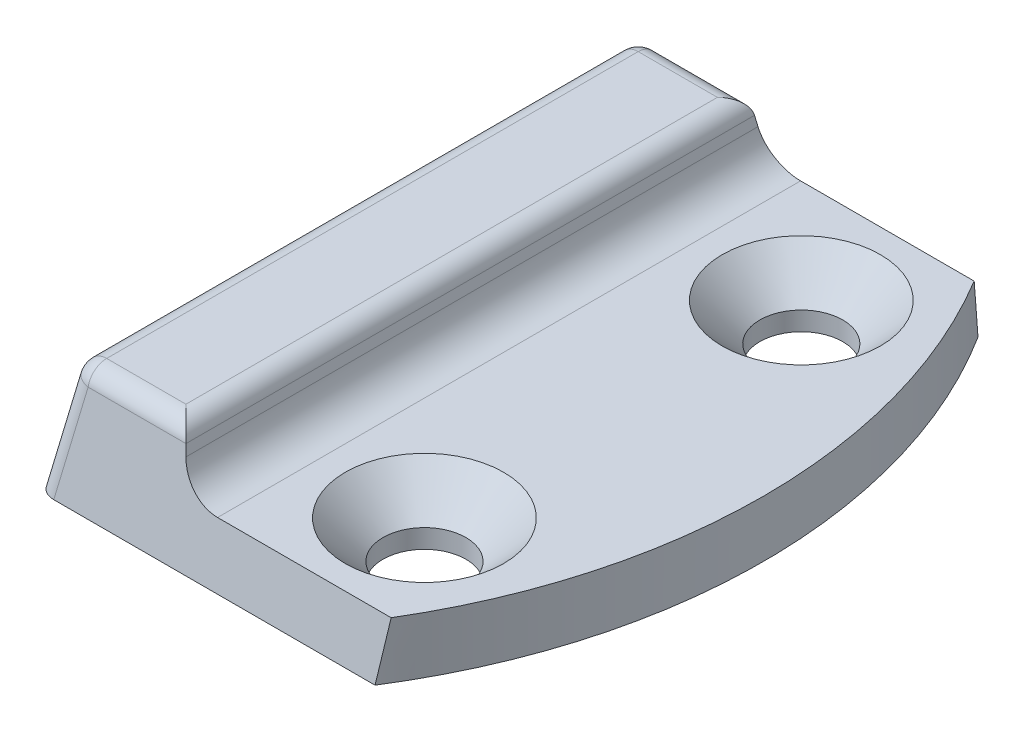
from build123d import *

# Parameters (mm, degrees)
SKETCH_1_W               = 4
SKETCH_1_H               = 16
EXTRUDE_1_DEPTH          = 3
EXTRUDE_1_TAPER          = 10
EXTRUDE_3_DEPTH          = 1.5
EXTRUDE_4_DEPTH          = 16
CUT_EXTRUDE_1_REACH      = 19.263
CUT_EXTRUDE_1_END_RADIUS = 15
SKETCH_6_R               = 1.1
CUT_EXTRUDE_2_DEPTH      = 18.066048222
CHAMFER_1_SIZE           = 1
FILLET_2_R               = 1
FILLET_3_R               = 0.5


with BuildPart() as part:
    # Эскиз1 → Бобышка-Вытянуть1 (new body)
    with BuildSketch(Plane(origin=(0, 0, 0), x_dir=(1, 0, 0), z_dir=(0, 1, 0))):
        with Locations((5.671019058, 0)):
            Rectangle(SKETCH_1_W, SKETCH_1_H)
    extrude(amount=EXTRUDE_1_DEPTH, taper=EXTRUDE_1_TAPER)



with BuildPart() as body_2:
    # Эскиз2 → Бобышка-Вытянуть3 (new body)
    with BuildSketch(Plane(origin=(0, 0, 0), x_dir=(1, 0, 0), z_dir=(0, 1, 0))):
        with BuildLine():
            Line((7.671019058, 8), (12.68857754, 8))
            ThreePointArc((12.68857754, 8), (15, 0), (12.68857754, -8))
            Line((12.68857754, -8), (7.671019058, -8))
            Line((7.671019058, -8), (7.671019058, 8))
        make_face()
    extrude(amount=EXTRUDE_3_DEPTH)


with BuildPart() as part_1:
    add(part.part)

    add(body_2.part)  # Бобышка-Вытянуть4 merges body 2
    # Эскиз3 → Бобышка-Вытянуть4 (add)
    with BuildSketch(Plane.XY.offset(8)):
        Polygon((7.671019058, 1.5), (7.406528587, 1.5), (7.671019058, 0), align=None)
    extrude(amount=-EXTRUDE_4_DEPTH)

    # Вырез-Вытянуть1: up to this cylinder (the profile starts inside it)
    cut_extrude_1_end = Plane(origin=(0, 1, 0), z_dir=(0, -1, 0)) * Cylinder(CUT_EXTRUDE_1_END_RADIUS, 69.526, mode=Mode.PRIVATE)
    # Эскиз5 → Вырез-Вытянуть1 (cut, up to the surface)
    with BuildSketch(Plane(origin=(0, 0, 0), x_dir=(0, 0, -1), z_dir=(1, 0, 0)), mode=Mode.PRIVATE) as cut_extrude_1_sk1:
        Polygon((-8, 0), (-8, 1.5), (-7.735509529, 1.5), align=None)
    cut_extrude_1_tool1 = extrude(cut_extrude_1_sk1.sketch, amount=CUT_EXTRUDE_1_REACH, mode=Mode.PRIVATE) & cut_extrude_1_end
    add(cut_extrude_1_tool1.solids().sort_by_distance((0, 1, 7.911837))[0], mode=Mode.SUBTRACT)
    # Эскиз5 → Вырез-Вытянуть1 (cut, up to the surface)
    with BuildSketch(Plane(origin=(0, 0, 0), x_dir=(0, 0, -1), z_dir=(1, 0, 0)), mode=Mode.PRIVATE) as cut_extrude_1_sk2:
        Polygon((7.735509529, 1.5), (8, 0), (8, 1.5), align=None)
    cut_extrude_1_tool2 = extrude(cut_extrude_1_sk2.sketch, amount=CUT_EXTRUDE_1_REACH, mode=Mode.PRIVATE) & cut_extrude_1_end
    add(cut_extrude_1_tool2.solids().sort_by_distance((0, 1, -7.911837))[0], mode=Mode.SUBTRACT)

    # Эскиз6 → Вырез-Вытянуть2 (cut, through all)
    with BuildSketch(Plane(origin=(0, 1.5, 0), x_dir=(1, 0, 0), z_dir=(0, 1, 0))):
        with Locations(Location((11, 5, 0), (0, 0, 180))):
            Circle(SKETCH_6_R)
        with Locations(Location((11, -5, 0), (0, 0, 180))):
            Circle(SKETCH_6_R)
    extrude(amount=-CUT_EXTRUDE_2_DEPTH, mode=Mode.SUBTRACT)

    # Фаска1
    chamfer_1_edges = [part_1.edges().sort_by_distance(p)[0] for p in [
        (12.1, 1.5, -5),
        (12.1, 1.5, 5),
    ]]
    chamfer(chamfer_1_edges, length=CHAMFER_1_SIZE)

    # Скругление2
    fillet_2_edges = [part_1.edges().sort_by_distance(p)[0] for p in [
        (7.406528587, 1.5, 0),
    ]]
    fillet(fillet_2_edges, radius=FILLET_2_R)

    # Скругление3
    fillet_3_edges = [part_1.edges().sort_by_distance(p)[0] for p in [
        (4.2, 3, 0),
        (5.671019058, 3, 7.471019058),
        (7.142038116, 3, 0),
        (3.935509529, 1.5, 7.735509529),
        (3.935509529, 1.5, -7.735509529),
        (5.671019058, 3, -7.471019058),
    ]]
    fillet(fillet_3_edges, radius=FILLET_3_R)


solid = part_1.part
